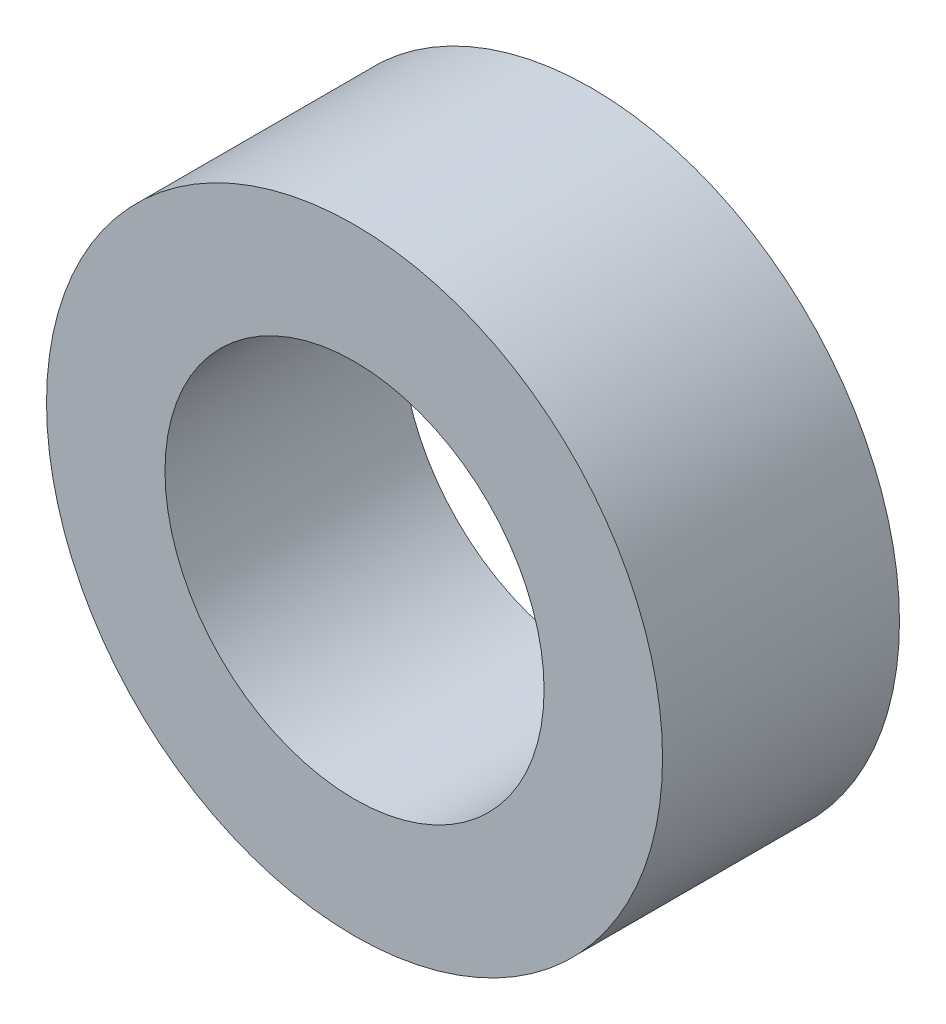
from build123d import *

# Parameters (mm, degrees)
SKETCH_1_R      = 13
SKETCH_1_R_2    = 8
EXTRUDE_1_DEPTH = 10


with BuildPart() as part:
    # 스케치1 → 보스-돌출1 (new body)
    with BuildSketch(Plane.XY):
        Circle(SKETCH_1_R)
        Circle(SKETCH_1_R_2, mode=Mode.SUBTRACT)
    extrude(amount=EXTRUDE_1_DEPTH)


solid = part.part
